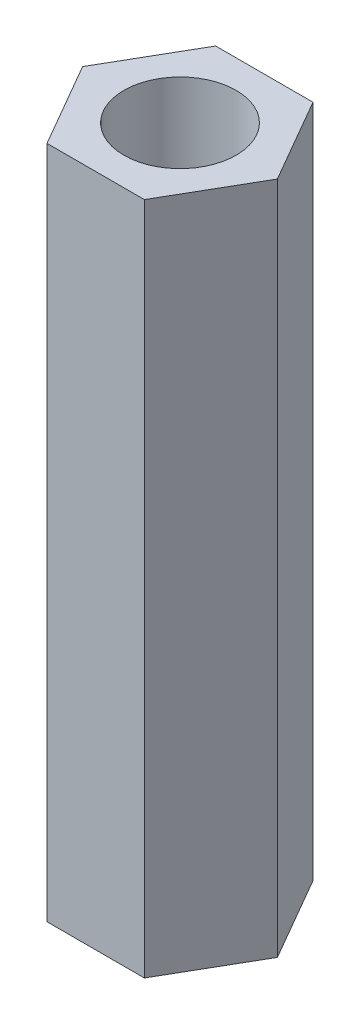
from build123d import *

# Parameters (mm, degrees)
SKETCH_1_R      = 1.5
EXTRUDE_1_DEPTH = 18


with BuildPart() as part:
    # 草图1 → 凸台-拉伸1 (new body)
    with BuildSketch(Plane(origin=(0, 0, 0), x_dir=(1, 0, 0), z_dir=(0, 1, 0))):
        Polygon((2.6, 0), (1.3, 2.25166605), (-1.3, 2.25166605), (-2.6, 0), (-1.3, -2.25166605), (1.3, -2.25166605), align=None)
        with Locations(Location((0, 0, 0), (0, 0, 270))):
            Circle(SKETCH_1_R, mode=Mode.SUBTRACT)
    extrude(amount=EXTRUDE_1_DEPTH)


solid = part.part
